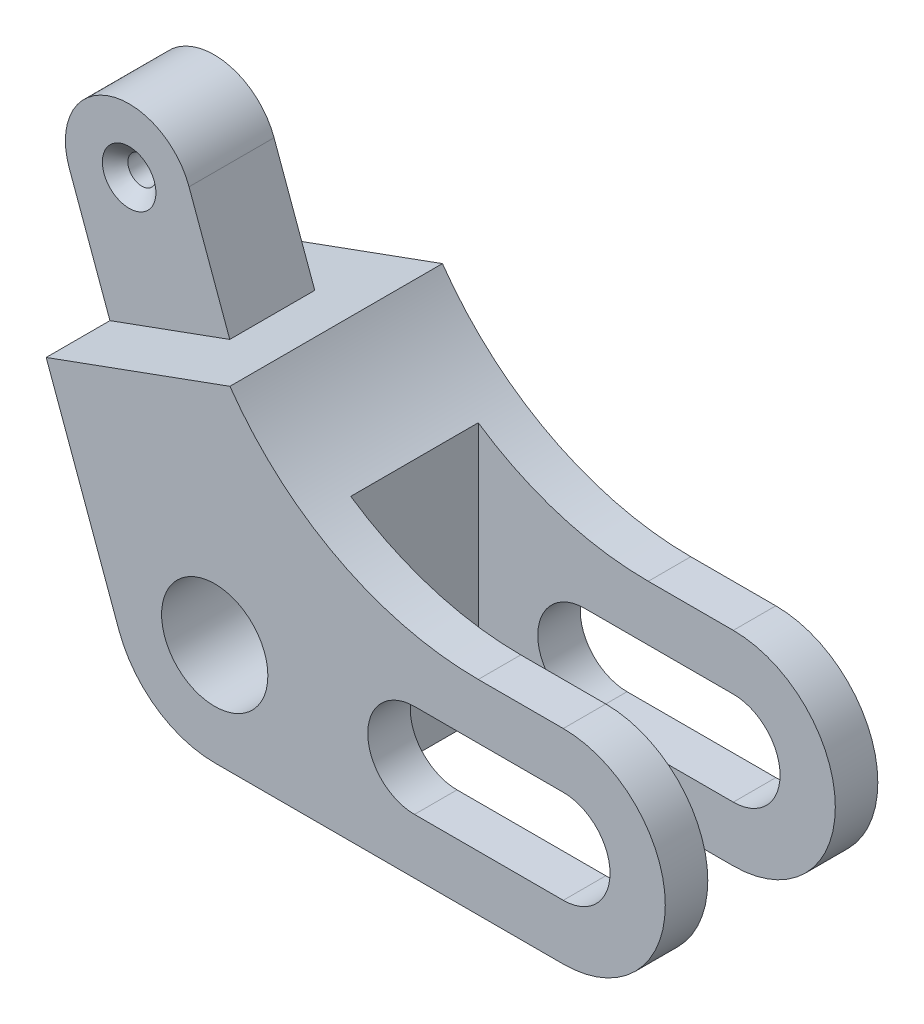
from build123d import *

# Parameters (mm, degrees)
SKETCH1_R                                       = 12.5
SKETCH1_R_2                                     = 3
BOSS_EXTRUDE1_DEPTH                             = 25
SKETCH2_W                                       = 15
SKETCH2_H                                       = 43
CUT_EXTRUDE1_DEPTH                              = 50
CUT_EXTRUDE2_DEPTH                              = 125.934480099
CUT_EXTRUDE2_DEPTH_BACK                         = 125.934480099
SKETCH4_W                                       = 100
SKETCH4_H                                       = 30
CSK_FOR_M6_FLAT_HEAD_MACHINE_SCREW1_D           = 6.6
CSK_FOR_M6_FLAT_HEAD_MACHINE_SCREW1_CSINK_D     = 12.6
CSK_FOR_M6_FLAT_HEAD_MACHINE_SCREW1_CSINK_ANGLE = 90


with BuildPart() as part:
    # Sketch1 → Boss-Extrude1 (new, symmetric)
    with BuildSketch(Plane.XY):
        with BuildLine():
            Line((0, -24), (82, -24))
            ThreePointArc((82, -24), (106, 0), (82, 24))
            Line((82, 24), (62, 24))
            ThreePointArc((62, 24), (29.043180304, 32.086461832), (3.572230491, 54.509074192))
            Line((3.572230491, 54.509074192), (-11.462851442, 49.036751899))
            Line((-11.462851442, 49.036751899), (-21.039415455, 75.348145281))
            ThreePointArc((-21.039415455, 75.348145281), (-40.265106916, 84.313232443), (-49.230194078, 65.087540981))
            Line((-49.230194078, 65.087540981), (-39.653630065, 38.776147599))
            Line((-39.653630065, 38.776147599), (-22.552622899, -8.20848344))
            ThreePointArc((-22.552622899, -8.20848344), (-13.765834472, -19.659649063), (0, -24))
        make_face()
        Circle(SKETCH1_R, mode=Mode.SUBTRACT)
        with Locations((-35.134804766, 70.217843131)):
            Circle(SKETCH1_R_2, mode=Mode.SUBTRACT)
        with BuildLine():
            Line((47, 11), (82, 11))
            ThreePointArc((82, 11), (93, 0), (82, -11))
            Line((82, -11), (47, -11))
            ThreePointArc((47, -11), (36, 0), (47, 11))
        make_face(mode=Mode.SUBTRACT)
    extrude(amount=BOSS_EXTRUDE1_DEPTH, both=True)

    # Sketch2 → Cut-Extrude1 (cut)
    with BuildSketch(Plane(origin=(5.638155725, 2.05212086, 0), x_dir=(0, 0, -1), z_dir=(0.9396926207859104, 0.3420201433256632, 0))):
        with Locations((-17.5, 71.5)):
            Rectangle(SKETCH2_W, SKETCH2_H)
        with Locations((17.5, 71.5)):
            Rectangle(SKETCH2_W, SKETCH2_H)
    extrude(amount=-CUT_EXTRUDE1_DEPTH, mode=Mode.SUBTRACT)

    # Sketch4 → Cut-Extrude2 (cut, two sides: drawn at the far end of the back side and taken through both)
    with BuildSketch(Plane(origin=(0, 24, 0), x_dir=(1, 0, 0), z_dir=(0, 1, 0)).offset(-CUT_EXTRUDE2_DEPTH_BACK)):
        with Locations((72, 0)):
            Rectangle(SKETCH4_W, SKETCH4_H)
    extrude(amount=CUT_EXTRUDE2_DEPTH + CUT_EXTRUDE2_DEPTH_BACK, mode=Mode.SUBTRACT)

    # CSK for M6 Flat Head Machine Screw1 (through all)
    with Locations(Plane.XY.offset(10)):
        with Locations((-35.134804766, 70.217843131)):
            CounterSinkHole(CSK_FOR_M6_FLAT_HEAD_MACHINE_SCREW1_D / 2, CSK_FOR_M6_FLAT_HEAD_MACHINE_SCREW1_CSINK_D / 2, counter_sink_angle=CSK_FOR_M6_FLAT_HEAD_MACHINE_SCREW1_CSINK_ANGLE)


solid = part.part
